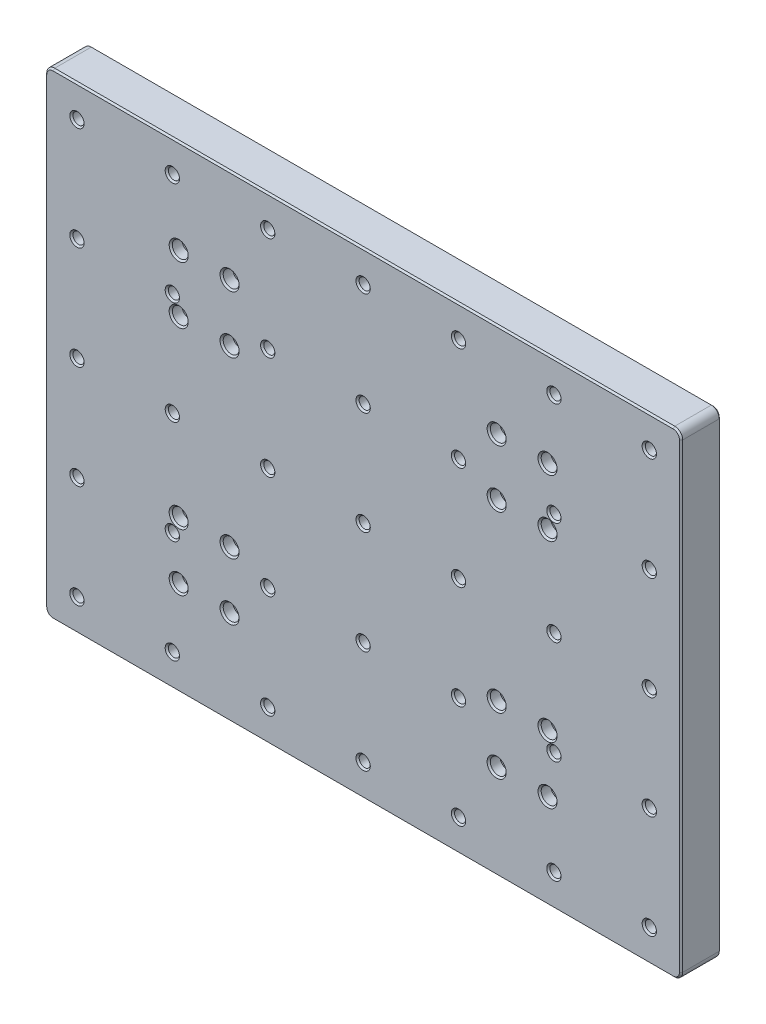
from build123d import *

# Parameters (mm, degrees)
SKETCH1_W                      = 400
SKETCH1_H                      = 300
BOSS_EXTRUDE1_DEPTH            = 25
CBORE_FOR_M5_SHCS1_D           = 5.5
CBORE_FOR_M5_SHCS1_DEPTH       = 28.347633298
CBORE_FOR_M5_SHCS1_CBORE_D     = 10
CBORE_FOR_M5_SHCS1_CBORE_DEPTH = 7
CBORE_FOR_M5_SHCS1_TIP         = 1.652366702
FILLET1_R                      = 5
SKETCH5_R                      = 3.5
CUT_EXTRUDE2_DEPTH             = 252.246890528
CHAMFER1_SIZE                  = 1
CHAMFER2_SIZE                  = 1


with BuildPart() as part:
    # Sketch1 → Boss-Extrude1 (new body)
    with BuildSketch(Plane.XY):
        Rectangle(SKETCH1_W, SKETCH1_H)
    extrude(amount=BOSS_EXTRUDE1_DEPTH)

    # CBORE for M5 SHCS1
    with Locations(Plane(origin=(-116, 90.75, 25), x_dir=(1, 0, 0), z_dir=(0, 0, 1))):
        with Locations((0, 0), (32, 0), (0, -36), (32, -36), (0, -145.5), (32, -145.5), (0, -181.5), (32, -181.5), (232, -181.5), (200, -181.5), (200, -145.5), (232, -145.5), (200, 0), (232, 0), (200, -36), (232, -36)):
            CounterBoreHole(CBORE_FOR_M5_SHCS1_D / 2, CBORE_FOR_M5_SHCS1_CBORE_D / 2, CBORE_FOR_M5_SHCS1_CBORE_DEPTH, depth=CBORE_FOR_M5_SHCS1_DEPTH)
            with Locations((0, 0, -(CBORE_FOR_M5_SHCS1_DEPTH + CBORE_FOR_M5_SHCS1_TIP / 2))):  # 118° drill point
                Cone(0, CBORE_FOR_M5_SHCS1_D / 2, CBORE_FOR_M5_SHCS1_TIP, mode=Mode.SUBTRACT)

    # Fillet1
    fillet1_edges = [part.edges().sort_by_distance(p)[0] for p in [
        (200, -150, 12.5),
        (-200, -150, 12.5),
        (-200, 150, 12.5),
        (200, 150, 12.5),
    ]]
    fillet(fillet1_edges, radius=FILLET1_R)

    # Sketch5 → Cut-Extrude2 (cut, through all)
    with BuildSketch(Plane.XY.offset(25)):
        with Locations((-180, 130)):
            Circle(SKETCH5_R)
        with Locations((-120, 130)):
            Circle(SKETCH5_R)
        with Locations((-60, 130)):
            Circle(SKETCH5_R)
        with Locations((0, 130)):
            Circle(SKETCH5_R)
        with Locations((60, 130)):
            Circle(SKETCH5_R)
        with Locations((120, 130)):
            Circle(SKETCH5_R)
        with Locations((180, 130)):
            Circle(SKETCH5_R)
        with Locations((-120, 65)):
            Circle(SKETCH5_R)
        with Locations((-60, 65)):
            Circle(SKETCH5_R)
        with Locations((0, 65)):
            Circle(SKETCH5_R)
        with Locations((60, 65)):
            Circle(SKETCH5_R)
        with Locations((120, 65)):
            Circle(SKETCH5_R)
        with Locations((180, 65)):
            Circle(SKETCH5_R)
        with Locations((-120, 0)):
            Circle(SKETCH5_R)
        with Locations((-60, 0)):
            Circle(SKETCH5_R)
        Circle(SKETCH5_R)
        with Locations((60, 0)):
            Circle(SKETCH5_R)
        with Locations((120, 0)):
            Circle(SKETCH5_R)
        with Locations((180, 0)):
            Circle(SKETCH5_R)
        with Locations((-120, -65)):
            Circle(SKETCH5_R)
        with Locations((-60, -65)):
            Circle(SKETCH5_R)
        with Locations((0, -65)):
            Circle(SKETCH5_R)
        with Locations((60, -65)):
            Circle(SKETCH5_R)
        with Locations((120, -65)):
            Circle(SKETCH5_R)
        with Locations((180, -65)):
            Circle(SKETCH5_R)
        with Locations((-120, -130)):
            Circle(SKETCH5_R)
        with Locations((-60, -130)):
            Circle(SKETCH5_R)
        with Locations((0, -130)):
            Circle(SKETCH5_R)
        with Locations((60, -130)):
            Circle(SKETCH5_R)
        with Locations((120, -130)):
            Circle(SKETCH5_R)
        with Locations((180, -130)):
            Circle(SKETCH5_R)
        with Locations((-180, 65)):
            Circle(SKETCH5_R)
        with Locations((-180, 0)):
            Circle(SKETCH5_R)
        with Locations((-180, -65)):
            Circle(SKETCH5_R)
        with Locations((-180, -130)):
            Circle(SKETCH5_R)
    extrude(amount=-CUT_EXTRUDE2_DEPTH, mode=Mode.SUBTRACT)

    # Chamfer1
    chamfer1_edges = [part.edges().sort_by_distance(p)[0] for p in [
        (-121, -90.75, 25),
        (-89, -54.75, 25),
        (-121, -54.75, 25),
        (-89, 54.75, 25),
        (-121, 54.75, 25),
        (-89, 90.75, 25),
        (-121, 90.75, 25),
        (0, 150, 25),
        (200, 0, 25),
        (-200, 0, 25),
        (0, -150, 25),
        (-198.535533906, 148.535533906, 25),
        (-198.535533906, -148.535533906, 25),
        (198.535533906, -148.535533906, 25),
        (198.535533906, 148.535533906, 25),
        (111, 54.75, 25),
        (176.5, -65, 25),
        (116.5, -65, 25),
        (56.5, -65, 25),
        (-3.5, -65, 25),
        (-63.5, -65, 25),
        (-123.5, -65, 25),
        (176.5, 0, 25),
        (116.5, 0, 25),
        (-183.5, 0, 25),
        (-183.5, 65, 25),
        (176.5, -130, 25),
        (116.5, -130, 25),
        (56.5, -130, 25),
        (-3.5, -130, 25),
        (-63.5, -130, 25),
        (-123.5, -130, 25),
        (-63.5, 65, 25),
        (-123.5, 65, 25),
        (176.5, 130, 25),
        (116.5, 130, 25),
        (56.5, 130, 25),
        (-3.5, 130, 25),
        (-63.5, 130, 25),
        (-123.5, 130, 25),
        (-3.5, 65, 25),
        (56.5, 65, 25),
        (116.5, 65, 25),
        (176.5, 65, 25),
        (-123.5, 0, 25),
        (-63.5, 0, 25),
        (-3.5, 0, 25),
        (56.5, 0, 25),
        (-183.5, -65, 25),
        (-183.5, -130, 25),
        (-183.5, 130, 25),
        (79, 54.75, 25),
        (111, 90.75, 25),
        (79, 90.75, 25),
        (111, -54.75, 25),
        (79, -54.75, 25),
        (79, -90.75, 25),
        (111, -90.75, 25),
        (-89, -90.75, 25),
    ]]
    chamfer(chamfer1_edges, length=CHAMFER1_SIZE)

    # Chamfer2
    chamfer2_edges = [part.edges().sort_by_distance(p)[0] for p in [
        (-113.25, -90.75, 0),
        (-81.25, -54.75, 0),
        (-113.25, -54.75, 0),
        (-81.25, 54.75, 0),
        (-113.25, 54.75, 0),
        (-81.25, 90.75, 0),
        (-113.25, 90.75, 0),
        (0, 150, 0),
        (200, 0, 0),
        (0, -150, 0),
        (-200, 0, 0),
        (-198.535533906, 148.535533906, 0),
        (-198.535533906, -148.535533906, 0),
        (198.535533906, -148.535533906, 0),
        (198.535533906, 148.535533906, 0),
        (118.75, 54.75, 0),
        (176.5, -65, 0),
        (116.5, -65, 0),
        (56.5, -65, 0),
        (-3.5, -65, 0),
        (-63.5, -65, 0),
        (-123.5, -65, 0),
        (176.5, 0, 0),
        (116.5, 0, 0),
        (-183.5, 0, 0),
        (-183.5, 65, 0),
        (176.5, -130, 0),
        (116.5, -130, 0),
        (56.5, -130, 0),
        (-3.5, -130, 0),
        (-63.5, -130, 0),
        (-123.5, -130, 0),
        (-63.5, 65, 0),
        (-123.5, 65, 0),
        (176.5, 130, 0),
        (116.5, 130, 0),
        (56.5, 130, 0),
        (-3.5, 130, 0),
        (-63.5, 130, 0),
        (-123.5, 130, 0),
        (-3.5, 65, 0),
        (56.5, 65, 0),
        (116.5, 65, 0),
        (176.5, 65, 0),
        (-123.5, 0, 0),
        (-63.5, 0, 0),
        (-3.5, 0, 0),
        (56.5, 0, 0),
        (-183.5, -65, 0),
        (-183.5, -130, 0),
        (-183.5, 130, 0),
        (86.75, 54.75, 0),
        (118.75, 90.75, 0),
        (86.75, 90.75, 0),
        (118.75, -54.75, 0),
        (86.75, -54.75, 0),
        (86.75, -90.75, 0),
        (118.75, -90.75, 0),
        (-81.25, -90.75, 0),
    ]]
    chamfer(chamfer2_edges, length=CHAMFER2_SIZE)


solid = part.part
